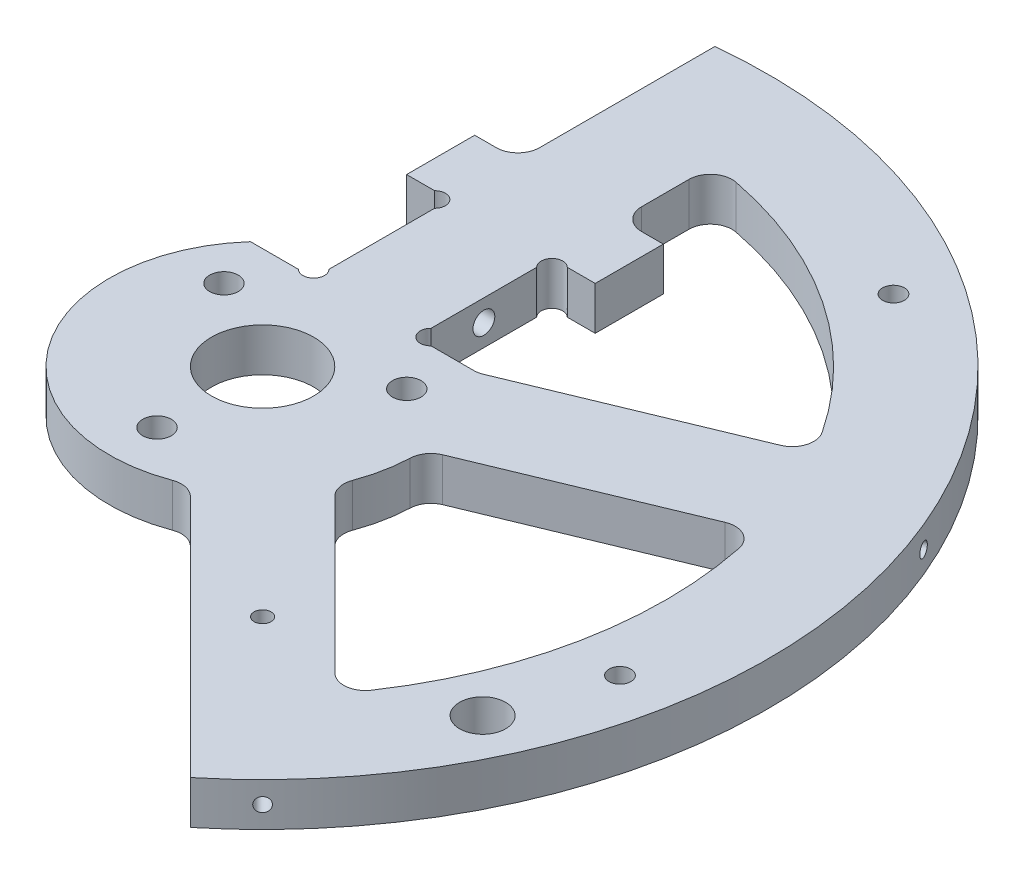
from build123d import *

# Parameters (mm, degrees)
SKETCH1_R                                       = 7.5
BOSS_EXTRUDE1_DEPTH                             = 3.175
M5X0_8_TAPPED_HOLE2_D                           = 4.2
CIRPATTERN1_COUNT                               = 3
CIRPATTERN1_ANGLE                               = 135
M3_CLEARANCE_HOLE1_D                            = 3.2
M3_CLEARANCE_HOLE1_DEPTH                        = 15
CSK_FOR_M3_FLAT_HEAD_MACHINE_SCREW1_D           = 3.2
CSK_FOR_M3_FLAT_HEAD_MACHINE_SCREW1_CSINK_D     = 6.3
CSK_FOR_M3_FLAT_HEAD_MACHINE_SCREW1_CSINK_ANGLE = 90
M3X0_5_TAPPED_HOLE1_D                           = 2.5
CUT_EXTRUDE1_REACH                              = 107.268
FILLET1_R                                       = 3.175
F_1_4_CLEARANCE_HOLE1_D                         = 6.7564


with BuildPart() as part:
    # Sketch1 → Boss-Extrude1 (new, symmetric)
    with BuildSketch(Plane(origin=(0, 0, 0), x_dir=(1, 0, 0), z_dir=(0, 1, 0))):
        with BuildLine():
            Line((-13.85, 35), (-7.5, 35))
            Line((-7.5, 35), (-7.5, 15))
            Line((-7.5, 15), (-16.770509831, 15))
            ThreePointArc((-16.770509831, 15), (-18.002512666, -13.496649128), (9.696699141, -20.303300859))
            Line((9.696699141, -20.303300859), (46.966384428, -57.572986146))
            ThreePointArc((46.966384428, -57.572986146), (68.644249266, 28.433379025), (-7.5, 73.920497834))
            Line((-7.5, 73.920497834), (-7.5, 45))
            Line((-7.5, 45), (-13.85, 45))
            Line((-13.85, 45), (-13.85, 35))
        make_face()
        with Locations(Location((0, 0, 0), (0, 0, 270))):
            Circle(SKETCH1_R, mode=Mode.SUBTRACT)
        with BuildLine():
            Line((20.303300859, -9.696699141), (46.898012061, -36.291410343))
            ThreePointArc((46.898012061, -36.291410343), (58.160567128, -11.568856096), (57.216234934, 15.581798996))
            Line((57.216234934, 15.581798996), (22.468570216, 1.188845008))
            ThreePointArc((22.468570216, 1.188845008), (22.067668809, -4.389532245), (20.303300859, -9.696699141))
        make_face(mode=Mode.SUBTRACT)
        with BuildLine():
            Line((7.5, 15), (7.5, 35))
            Line((7.5, 35), (13.85, 35))
            Line((13.85, 35), (13.85, 45))
            Line((13.85, 45), (7.5, 45))
            Line((7.5, 45), (7.5, 58.823804705))
            ThreePointArc((7.5, 58.823804705), (32.945314818, 49.30614801), (51.475983449, 29.439991983))
            Line((51.475983449, 29.439991983), (16.72831873, 15.047037996))
            Line((16.72831873, 15.047037996), (16.614758962, 15))
            Line((16.614758962, 15), (7.5, 15))
        make_face(mode=Mode.SUBTRACT)
    extrude(amount=BOSS_EXTRUDE1_DEPTH, both=True)

    # M5x0.8 Tapped Hole2 (through all)
    with Locations(Plane(origin=(0, 3.175, 0), x_dir=(1, 0, 0), z_dir=(0, 1, 0))):
        with Locations((0, -15.5), (-13.423393759, 7.75), (13.423393759, 7.75)):
            Hole(M5X0_8_TAPPED_HOLE2_D / 2)

    # Sketch5 → M2.5x0.45 Tapped Hole1 (revolve, cut)
    with BuildSketch(Plane(origin=(0, 0, -74.3), x_dir=(0, 1, 0), z_dir=(1, 0, 0))):
        Polygon((0, 0), (0, 10.615882135), (1.025, 10), (1.025, 0), align=None)
    m2_5x0_45_tapped_hole1 = revolve(axis=Axis((0, 0, -80.65), (0, 0, 1)), mode=Mode.SUBTRACT)

    # CirPattern1: M2.5x0.45 Tapped Hole1 ×3 about axis
    cirpattern1_axis = Axis((0, 3.175, 0), (0, -1, 0))
    for i in range(1, CIRPATTERN1_COUNT):
        add(m2_5x0_45_tapped_hole1.rotate(cirpattern1_axis, i * CIRPATTERN1_ANGLE / (CIRPATTERN1_COUNT - 1)), mode=Mode.SUBTRACT)

    # M3 Clearance Hole1
    with Locations(Plane.ZY.offset(7.5)):
        with Locations((-25, 0)):
            Hole(M3_CLEARANCE_HOLE1_D / 2, depth=M3_CLEARANCE_HOLE1_DEPTH)

    # CSK for M3 Flat Head Machine Screw1 (through all)
    with Locations(Plane(origin=(0, -3.175, 0), x_dir=(-1, 0, 0), z_dir=(0, -1, 0))):
        with Locations((-37.112091566, 55.542170102), (-65.516456731, -13.032033511)):
            CounterSinkHole(CSK_FOR_M3_FLAT_HEAD_MACHINE_SCREW1_D / 2, CSK_FOR_M3_FLAT_HEAD_MACHINE_SCREW1_CSINK_D / 2, counter_sink_angle=CSK_FOR_M3_FLAT_HEAD_MACHINE_SCREW1_CSINK_ANGLE)

    # M3x0.5 Tapped Hole1 (through all)
    with Locations(Plane(origin=(0, -3.175, 0), x_dir=(-1, 0, 0), z_dir=(0, -1, 0))):
        with Locations((-31.819805153, -31.819805153)):
            Hole(M3X0_5_TAPPED_HOLE1_D / 2)

    # Sketch12 → Cut-Extrude1 (cut, up to next)
    with BuildSketch(Plane(origin=(0, 3.175, 0), x_dir=(1, 0, 0), z_dir=(0, 1, 0)), mode=Mode.PRIVATE) as cut_extrude1_sk1:
        with BuildLine():
            ThreePointArc((-7.035032015, 16.122532015), (-7.155873257, 16.730041964), (-7.5, 17.24506403))
            Line((-7.5, 17.24506403), (-7.5, 16.122532015))
            Line((-7.5, 16.122532015), (-7.5, 15))
            ThreePointArc((-7.5, 15), (-7.155873257, 15.515022066), (-7.035032015, 16.122532015))
        make_face()
    cut_extrude1_tool1 = extrude(cut_extrude1_sk1.sketch, amount=-CUT_EXTRUDE1_REACH, mode=Mode.PRIVATE) & part.part
    # Sketch12 → Cut-Extrude1 (cut, up to next)
    with BuildSketch(Plane(origin=(0, 3.175, 0), x_dir=(1, 0, 0), z_dir=(0, 1, 0)), mode=Mode.PRIVATE) as cut_extrude1_sk2:
        with BuildLine():
            Line((-8.622532015, 15), (-9.74506403, 15))
            ThreePointArc((-9.74506403, 15), (-8.622532015, 14.535032015), (-7.5, 15))
            Line((-7.5, 15), (-8.622532015, 15))
        make_face()
    cut_extrude1_tool2 = extrude(cut_extrude1_sk2.sketch, amount=-CUT_EXTRUDE1_REACH, mode=Mode.PRIVATE) & part.part
    # Sketch12 → Cut-Extrude1 (cut, up to next)
    with BuildSketch(Plane(origin=(0, 3.175, 0), x_dir=(1, 0, 0), z_dir=(0, 1, 0)), mode=Mode.PRIVATE) as cut_extrude1_sk3:
        with BuildLine():
            Line((8.622532015, 15), (7.5, 15))
            ThreePointArc((7.5, 15), (8.622532015, 14.535032015), (9.74506403, 15))
            Line((9.74506403, 15), (8.622532015, 15))
        make_face()
    cut_extrude1_tool3 = extrude(cut_extrude1_sk3.sketch, amount=-CUT_EXTRUDE1_REACH, mode=Mode.PRIVATE) & part.part
    # Sketch12 → Cut-Extrude1 (cut, up to next)
    with BuildSketch(Plane(origin=(0, 3.175, 0), x_dir=(1, 0, 0), z_dir=(0, 1, 0)), mode=Mode.PRIVATE) as cut_extrude1_sk4:
        with BuildLine():
            Line((7.5, 16.122532015), (7.5, 17.24506403))
            ThreePointArc((7.5, 17.24506403), (7.035032015, 16.122532015), (7.5, 15))
            Line((7.5, 15), (7.5, 16.122532015))
        make_face()
    cut_extrude1_tool4 = extrude(cut_extrude1_sk4.sketch, amount=-CUT_EXTRUDE1_REACH, mode=Mode.PRIVATE) & part.part
    # Sketch12 → Cut-Extrude1 (cut, up to next)
    with BuildSketch(Plane(origin=(0, 3.175, 0), x_dir=(1, 0, 0), z_dir=(0, 1, 0)), mode=Mode.PRIVATE) as cut_extrude1_sk5:
        with BuildLine():
            Line((7.5, 33.877467985), (7.5, 35))
            ThreePointArc((7.5, 35), (7.035032015, 33.877467985), (7.5, 32.75493597))
            Line((7.5, 32.75493597), (7.5, 33.877467985))
        make_face()
    cut_extrude1_tool5 = extrude(cut_extrude1_sk5.sketch, amount=-CUT_EXTRUDE1_REACH, mode=Mode.PRIVATE) & part.part
    # Sketch12 → Cut-Extrude1 (cut, up to next)
    with BuildSketch(Plane(origin=(0, 3.175, 0), x_dir=(1, 0, 0), z_dir=(0, 1, 0)), mode=Mode.PRIVATE) as cut_extrude1_sk6:
        with BuildLine():
            ThreePointArc((9.74506403, 35), (8.622532015, 35.464967985), (7.5, 35))
            Line((7.5, 35), (8.622532015, 35))
            Line((8.622532015, 35), (9.74506403, 35))
        make_face()
    cut_extrude1_tool6 = extrude(cut_extrude1_sk6.sketch, amount=-CUT_EXTRUDE1_REACH, mode=Mode.PRIVATE) & part.part
    # Sketch12 → Cut-Extrude1 (cut, up to next)
    with BuildSketch(Plane(origin=(0, 3.175, 0), x_dir=(1, 0, 0), z_dir=(0, 1, 0)), mode=Mode.PRIVATE) as cut_extrude1_sk7:
        with BuildLine():
            ThreePointArc((-7.035032015, 33.877467985), (-7.155873257, 34.484977934), (-7.5, 35))
            Line((-7.5, 35), (-7.5, 33.877467985))
            Line((-7.5, 33.877467985), (-7.5, 32.75493597))
            ThreePointArc((-7.5, 32.75493597), (-7.155873257, 33.269958036), (-7.035032015, 33.877467985))
        make_face()
    cut_extrude1_tool7 = extrude(cut_extrude1_sk7.sketch, amount=-CUT_EXTRUDE1_REACH, mode=Mode.PRIVATE) & part.part
    # Sketch12 → Cut-Extrude1 (cut, up to next)
    with BuildSketch(Plane(origin=(0, 3.175, 0), x_dir=(1, 0, 0), z_dir=(0, 1, 0)), mode=Mode.PRIVATE) as cut_extrude1_sk8:
        with BuildLine():
            Line((-8.622532015, 35), (-7.5, 35))
            ThreePointArc((-7.5, 35), (-8.622532015, 35.464967985), (-9.74506403, 35))
            Line((-9.74506403, 35), (-8.622532015, 35))
        make_face()
    cut_extrude1_tool8 = extrude(cut_extrude1_sk8.sketch, amount=-CUT_EXTRUDE1_REACH, mode=Mode.PRIVATE) & part.part
    add(cut_extrude1_tool1.solids().sort_by_distance((-7.311461, 3.175, -16.122532))[0], mode=Mode.SUBTRACT)
    add(cut_extrude1_tool2.solids().sort_by_distance((-8.622532, 3.175, -14.811461))[0], mode=Mode.SUBTRACT)
    add(cut_extrude1_tool3.solids().sort_by_distance((8.622532, 3.175, -14.811461))[0], mode=Mode.SUBTRACT)
    add(cut_extrude1_tool4.solids().sort_by_distance((7.311461, 3.175, -16.122532))[0], mode=Mode.SUBTRACT)
    add(cut_extrude1_tool5.solids().sort_by_distance((7.311461, 3.175, -33.877468))[0], mode=Mode.SUBTRACT)
    add(cut_extrude1_tool6.solids().sort_by_distance((8.622532, 3.175, -35.188539))[0], mode=Mode.SUBTRACT)
    add(cut_extrude1_tool7.solids().sort_by_distance((-7.311461, 3.175, -33.877468))[0], mode=Mode.SUBTRACT)
    add(cut_extrude1_tool8.solids().sort_by_distance((-8.622532, 3.175, -35.188539))[0], mode=Mode.SUBTRACT)

    # Fillet1
    fillet1_edges = [part.edges().sort_by_distance(p)[0] for p in [
        (-7.5, 0, -45),
        (9.696699141, 0, 20.303300859),
        (7.5, 0, -58.823804705),
        (7.5, 0, -45),
        (16.614758962, 0, -15),
        (51.475983449, 0, -29.439991983),
        (46.898012061, 0, 36.291410343),
        (57.216234934, 0, -15.581798996),
        (22.468570216, 0, -1.188845008),
        (20.303300859, 0, 9.696699141),
    ]]
    fillet(fillet1_edges, radius=FILLET1_R)

    # 1/4 Clearance Hole1 (through all)
    with Locations(Plane(origin=(0, 3.175, 0), x_dir=(1, 0, 0), z_dir=(0, 1, 0))):
        with Locations((60.541360174, -28.230899884)):
            Hole(F_1_4_CLEARANCE_HOLE1_D / 2)


solid = part.part
